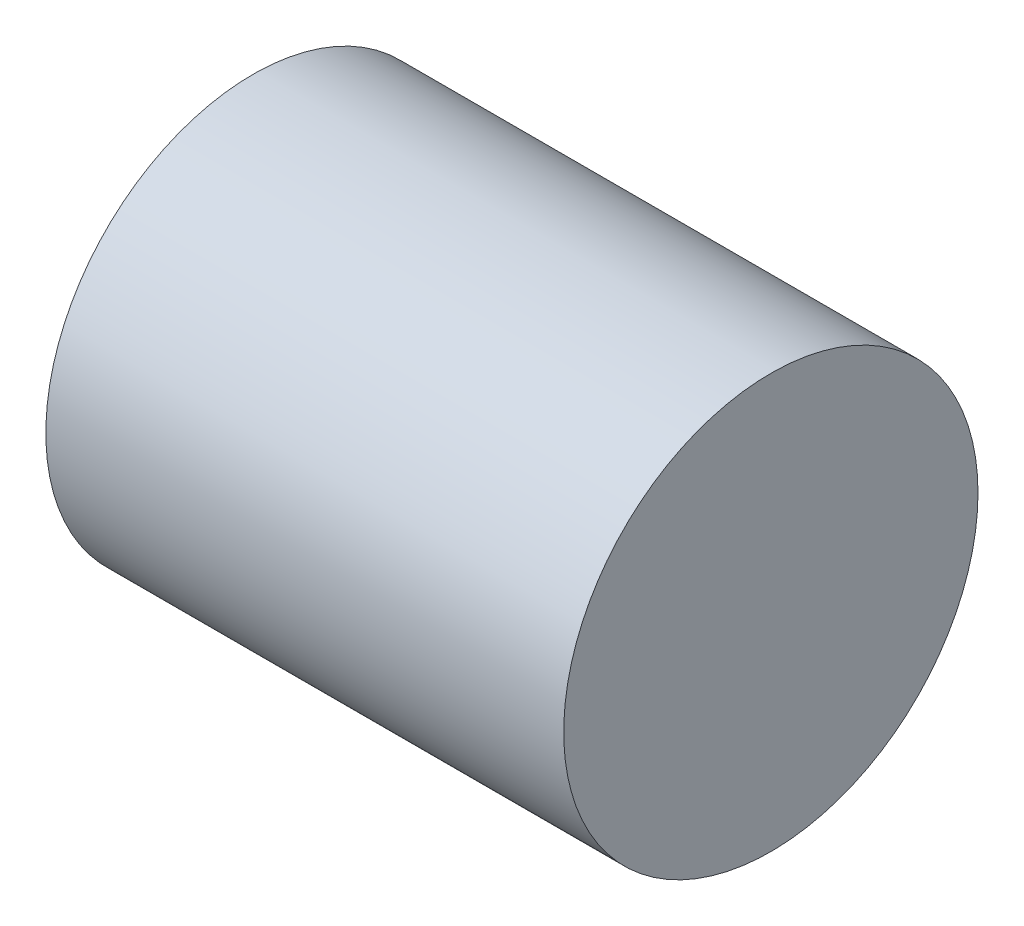
from build123d import *

# Parameters (mm, degrees)
SKETCH1_R           = 4
BOSS_EXTRUDE1_DEPTH = 10
SKETCH2_R           = 1.5
CUT_EXTRUDE1_DEPTH  = 5


with BuildPart() as part:
    # Sketch1 → Boss-Extrude1 (new body)
    with BuildSketch(Plane(origin=(0, 0, 0), x_dir=(0, 0, -1), z_dir=(1, 0, 0))):
        Circle(SKETCH1_R)
    extrude(amount=BOSS_EXTRUDE1_DEPTH)

    # Sketch2 → Cut-Extrude1 (cut)
    with BuildSketch(Plane.ZY):
        Circle(SKETCH2_R)
    extrude(amount=-CUT_EXTRUDE1_DEPTH, mode=Mode.SUBTRACT)


solid = part.part
